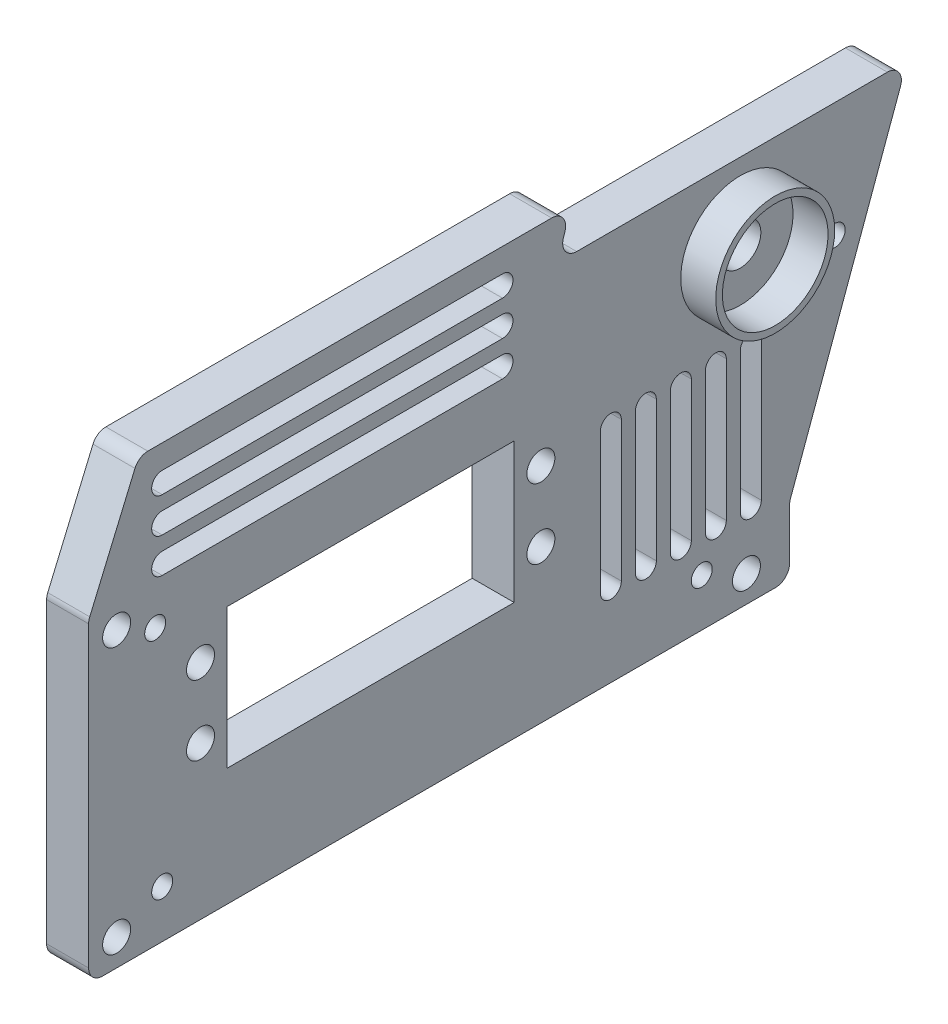
from build123d import *

# Parameters (mm, degrees)
EXTRUDE_1_DEPTH     = 6
SKETCH_2_R          = 2
CUT_EXTRUDE_1_DEPTH = 10
SKETCH_4_R          = 1.5
CUT_EXTRUDE_2_DEPTH = 6
SKETCH_7_R          = 2
SKETCH_7_R_2        = 1.5
CUT_EXTRUDE_3_DEPTH = 6
SKETCH_5_R          = 8.5
EXTRUDE_4_DEPTH     = 5
SKETCH_14_R         = 7.55
CUT_EXTRUDE_8_DEPTH = 5
SKETCH_15_R         = 2.95
CUT_EXTRUDE_9_DEPTH = 6
FILLET_1_R          = 2


with BuildPart() as part:
    # 草图1 → 凸台-拉伸1 (new body)
    with BuildSketch(Plane(origin=(0, 0, 0), x_dir=(0, 0, -1), z_dir=(1, 0, 0))):
        Polygon((-58.108525398, 10), (-58.108525398, -35), (42.059282617, -35), (42.059282617, -30.677521513), (42.059282617, -25.387821403), (52.220185328, 2.502083897), (58.88447221, 20.794388757), (53.88447221, 20.794388757), (8.88447221, 20.794388757), (10.802160114, 26.733589605), (-8.108525398, 26.733589605), (-50.96776046, 26.733589605), align=None)
    extrude(amount=EXTRUDE_1_DEPTH)

    # 草图2 → 切除-拉伸1 (cut)
    with BuildSketch(Plane(origin=(0, 0, 0), x_dir=(0, 0, -1), z_dir=(1, 0, 0))):
        with Locations((6.512667985, -3.171691559)):
            Circle(SKETCH_2_R)
        with Locations((6.512667985, -13.171691559)):
            Circle(SKETCH_2_R)
        with Locations(Location((-42.117332015, -13.171691559, 0), (0, 0, 180))):
            Circle(SKETCH_2_R)
        with Locations(Location((-42.117332015, -3.171691559, 0), (0, 0, 180))):
            Circle(SKETCH_2_R)
        Polygon((-17.802332015, 1.828308441), (-38.302332015, 1.828308441), (-38.302332015, -18.171691559), (-17.802332015, -18.171691559), (2.697667985, -18.171691559), (2.697667985, 1.828308441), align=None)
    extrude(amount=CUT_EXTRUDE_1_DEPTH, mode=Mode.SUBTRACT)

    # 草图4 → 切除-拉伸2 (cut)
    with BuildSketch(Plane(origin=(6, 0, 0), x_dir=(0, 0, -1), z_dir=(1, 0, 0))):
        with Locations((-48.59776046, 4.328308441)):
            Circle(SKETCH_4_R)
        with Locations((48.50223954, 4.328308441)):
            Circle(SKETCH_4_R)
    extrude(amount=-CUT_EXTRUDE_2_DEPTH, mode=Mode.SUBTRACT)

    # 草图7 → 切除-拉伸3 (cut)
    with BuildSketch(Plane(origin=(6, 0, 0), x_dir=(0, 0, -1), z_dir=(1, 0, 0))):
        with Locations((-54.108525398, 6.828308441)):
            Circle(SKETCH_7_R)
        with Locations((35.891474602, -31.171691559)):
            Circle(SKETCH_7_R)
        with Locations((-54.108525398, -31.171691559)):
            Circle(SKETCH_7_R)
        with BuildLine():
            ThreePointArc((18.012667985, -3.171691559), (16.512667985, -1.671691559), (15.012667985, -3.171691559))
            Line((15.012667985, -3.171691559), (15.012667985, -23.171691559))
            ThreePointArc((15.012667985, -23.171691559), (16.512667985, -24.671691559), (18.012667985, -23.171691559))
            Line((18.012667985, -23.171691559), (18.012667985, -3.171691559))
        make_face()
        with BuildLine():
            Line((1.03223954, 18.328308441), (-47.59776046, 18.328308441))
            ThreePointArc((-47.59776046, 18.328308441), (-49.09776046, 16.828308441), (-47.59776046, 15.328308441))
            Line((-47.59776046, 15.328308441), (1.03223954, 15.328308441))
            ThreePointArc((1.03223954, 15.328308441), (2.53223954, 16.828308441), (1.03223954, 18.328308441))
        make_face()
        with BuildLine():
            Line((1.03223954, 23.328308441), (-47.59776046, 23.328308441))
            ThreePointArc((-47.59776046, 23.328308441), (-49.09776046, 21.828308441), (-47.59776046, 20.328308441))
            Line((-47.59776046, 20.328308441), (1.03223954, 20.328308441))
            ThreePointArc((1.03223954, 20.328308441), (2.53223954, 21.828308441), (1.03223954, 23.328308441))
        make_face()
        with BuildLine():
            Line((1.03223954, 13.328308441), (-47.59776046, 13.328308441))
            ThreePointArc((-47.59776046, 13.328308441), (-49.09776046, 11.828308441), (-47.59776046, 10.328308441))
            Line((-47.59776046, 10.328308441), (1.03223954, 10.328308441))
            ThreePointArc((1.03223954, 10.328308441), (2.53223954, 11.828308441), (1.03223954, 13.328308441))
        make_face()
        with BuildLine():
            ThreePointArc((38.012667985, -3.171691559), (36.512667985, -1.671691559), (35.012667985, -3.171691559))
            Line((35.012667985, -3.171691559), (35.012667985, -23.171691559))
            ThreePointArc((35.012667985, -23.171691559), (36.512667985, -24.671691559), (38.012667985, -23.171691559))
            Line((38.012667985, -23.171691559), (38.012667985, -3.171691559))
        make_face()
        with BuildLine():
            ThreePointArc((23.012667985, -3.171691559), (21.512667985, -1.671691559), (20.012667985, -3.171691559))
            Line((20.012667985, -3.171691559), (20.012667985, -23.171691559))
            ThreePointArc((20.012667985, -23.171691559), (21.512667985, -24.671691559), (23.012667985, -23.171691559))
            Line((23.012667985, -23.171691559), (23.012667985, -3.171691559))
        make_face()
        with BuildLine():
            ThreePointArc((28.012667985, -3.171691559), (26.512667985, -1.671691559), (25.012667985, -3.171691559))
            Line((25.012667985, -3.171691559), (25.012667985, -23.171691559))
            ThreePointArc((25.012667985, -23.171691559), (26.512667985, -24.671691559), (28.012667985, -23.171691559))
            Line((28.012667985, -23.171691559), (28.012667985, -3.171691559))
        make_face()
        with BuildLine():
            ThreePointArc((33.012667985, -3.171691559), (31.512667985, -1.671691559), (30.012667985, -3.171691559))
            Line((30.012667985, -3.171691559), (30.012667985, -23.171691559))
            ThreePointArc((30.012667985, -23.171691559), (31.512667985, -24.671691559), (33.012667985, -23.171691559))
            Line((33.012667985, -23.171691559), (33.012667985, -3.171691559))
        make_face()
        with Locations((-47.59776046, -28.171691559)):
            Circle(SKETCH_7_R_2)
        with Locations((29.50223954, -28.171691559)):
            Circle(SKETCH_7_R_2)
    extrude(amount=-CUT_EXTRUDE_3_DEPTH, mode=Mode.SUBTRACT)

    # 草图5 → 凸台-拉伸4 (add)
    with BuildSketch(Plane(origin=(6, 0, 0), x_dir=(0, 0, -1), z_dir=(1, 0, 0))):
        with Locations((35, 10)):
            Circle(SKETCH_5_R)
    extrude(amount=EXTRUDE_4_DEPTH)

    # 草图14 → 切除-拉伸8 (cut)
    with BuildSketch(Plane(origin=(11, 0, 0), x_dir=(0, 0, -1), z_dir=(1, 0, 0))):
        with Locations((35, 10)):
            Circle(SKETCH_14_R)
    extrude(amount=-CUT_EXTRUDE_8_DEPTH, mode=Mode.SUBTRACT)

    # 草图15 → 切除-拉伸9 (cut)
    with BuildSketch(Plane(origin=(6, 0, 0), x_dir=(0, 0, -1), z_dir=(1, 0, 0))):
        with Locations((35, 10)):
            Circle(SKETCH_15_R)
    extrude(amount=-CUT_EXTRUDE_9_DEPTH, mode=Mode.SUBTRACT)

    # 圆角1
    fillet_1_edges = [part.edges().sort_by_distance(p)[0] for p in [
        (3, 10, 58.108525398),
        (3, 26.733589605, 50.96776046),
        (3, 26.733589605, -10.802160114),
        (3, 20.794388757, -8.88447221),
        (3, 20.794388757, -58.88447221),
        (3, -25.387821403, -42.059282617),
        (3, -35, -42.059282617),
        (3, -35, 58.108525398),
    ]]
    fillet(fillet_1_edges, radius=FILLET_1_R)


solid = part.part
